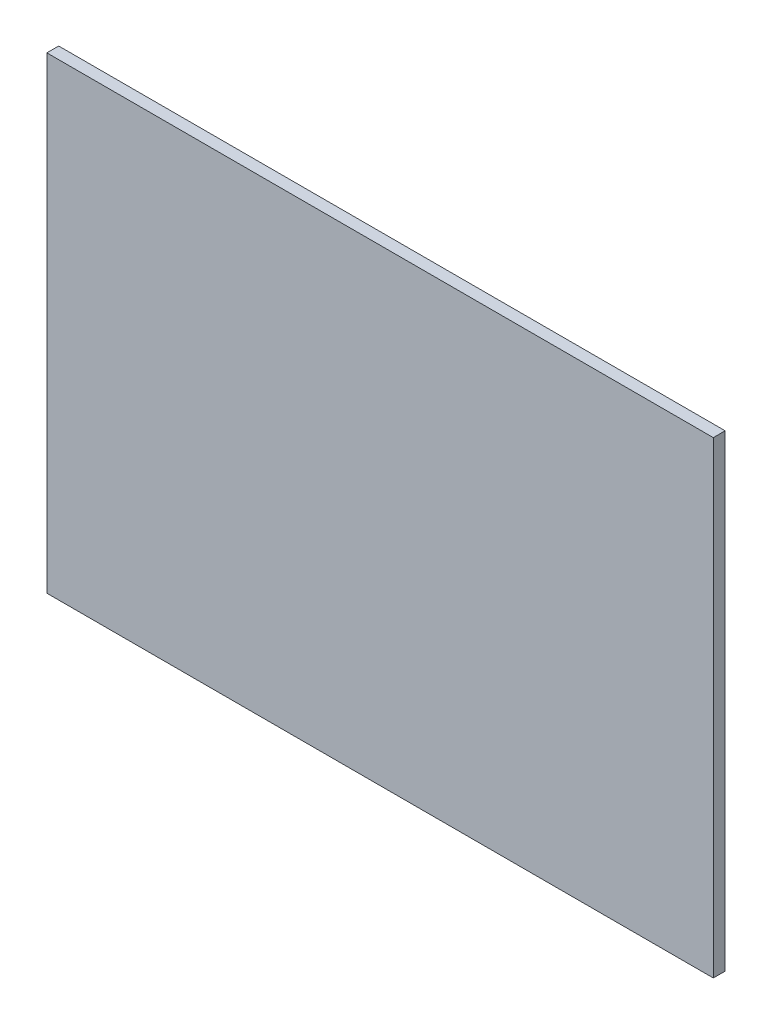
from build123d import *

# Parameters (mm, degrees)
BOSS_EXTRUDE1_DEPTH = 3.2


with BuildPart() as part:
    # Sketch1 → Boss-Extrude1 (new body)
    with BuildSketch(Plane.XY):
        Polygon((22.500001148, -3.2), (22.500001148, 9.999999357), (22.500001148, 109.999999357), (22.500001148, 123.199998713), (-157.49999917, 123.199998713), (-157.49999917, -3.2), align=None)
    extrude(amount=BOSS_EXTRUDE1_DEPTH)


solid = part.part
